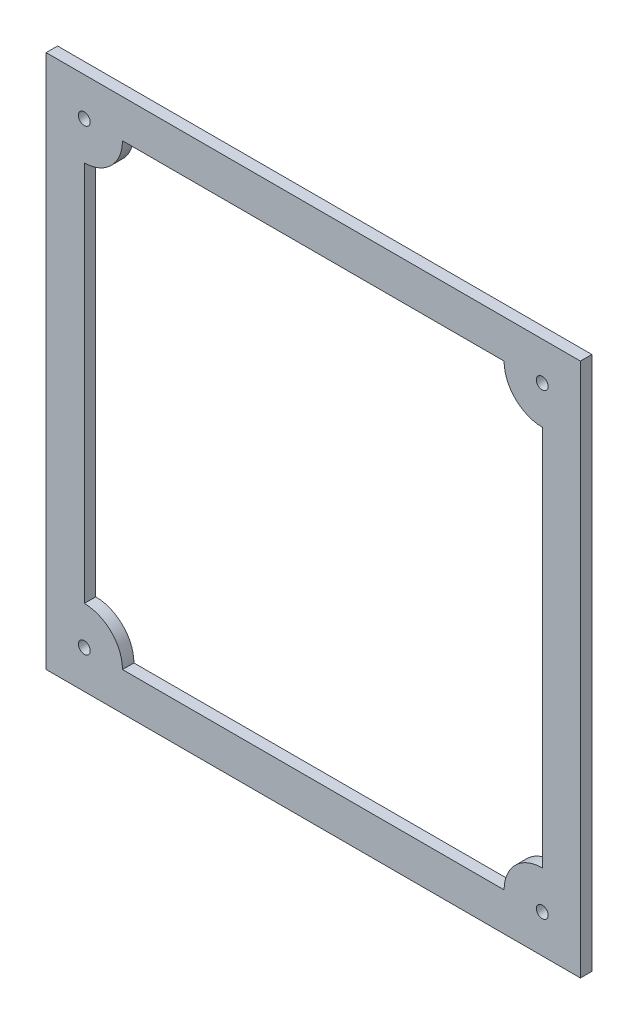
from build123d import *

# Parameters (mm, degrees)
SKETCH_1_W          = 140
SKETCH_1_H          = 140
SKETCH_1_R          = 1.55
EXTRUDE_1_DEPTH     = 3
CUT_EXTRUDE_1_DEPTH = 100.040395799


with BuildPart() as part:
    # 草圖1 → 填料-伸長1 (new body)
    with BuildSketch(Plane.XY):
        Rectangle(SKETCH_1_W, SKETCH_1_H)
        with Locations((-60, 60)):
            Circle(SKETCH_1_R, mode=Mode.SUBTRACT)
        with Locations((60, 60)):
            Circle(SKETCH_1_R, mode=Mode.SUBTRACT)
        with Locations((60, -60)):
            Circle(SKETCH_1_R, mode=Mode.SUBTRACT)
        with Locations((-60, -60)):
            Circle(SKETCH_1_R, mode=Mode.SUBTRACT)
    extrude(amount=EXTRUDE_1_DEPTH)

    # 草圖2 → 除料-伸長1 (cut, through all)
    with BuildSketch(Plane.XY.offset(3)):
        with BuildLine():
            Line((-50, -60), (50, -60))
            ThreePointArc((50, -60), (52.928932188, -52.928932188), (60, -50))
            Line((60, -50), (60, 50))
            ThreePointArc((60, 50), (52.928932188, 52.928932188), (50, 60))
            Line((50, 60), (-50, 60))
            ThreePointArc((-50, 60), (-52.928932188, 52.928932188), (-60, 50))
            Line((-60, 50), (-60, -50))
            ThreePointArc((-60, -50), (-52.928932188, -52.928932188), (-50, -60))
        make_face()
    extrude(amount=-CUT_EXTRUDE_1_DEPTH, mode=Mode.SUBTRACT)


solid = part.part
